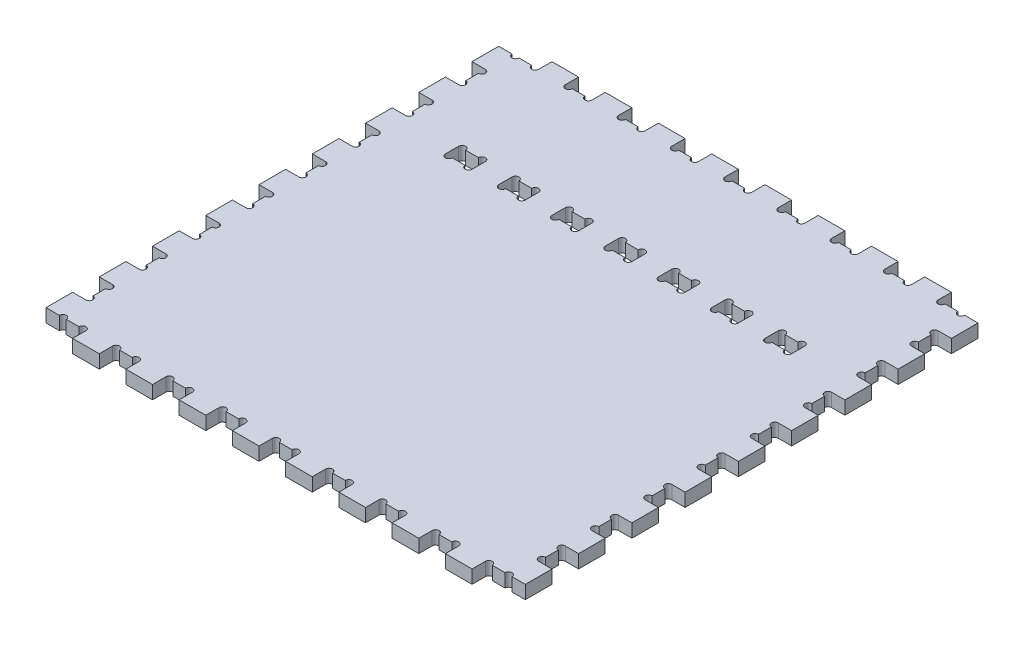
from build123d import *

# Parameters (mm, degrees)
SKETCH1_W               = 457.2
SKETCH1_H               = 457.2
BOSS_EXTRUDE1_DEPTH     = 12.7
CUT_EXTRUDE1_DEPTH      = 12.7
LPATTERN1_COUNT         = 9
LPATTERN1_PITCH         = 50.8
MIRROR1_COPY_1_DEPTH    = 12.7
MIRROR1_COPY_2_DEPTH    = 12.7
MIRROR1_COPY_3_DEPTH    = 12.7
MIRROR1_COPY_4_DEPTH    = 12.7
MIRROR1_COPY_5_DEPTH    = 12.7
MIRROR1_COPY_6_DEPTH    = 12.7
MIRROR1_COPY_7_DEPTH    = 12.7
MIRROR1_COPY_8_DEPTH    = 12.7
SKETCH3_W               = 12.7
SKETCH3_H               = 12.7
CUT_EXTRUDE2_DEPTH      = 324.538575753
MIRROR3_COPY_1_SKETCH_W = 12.7
MIRROR3_COPY_1_SKETCH_H = 12.7
MIRROR3_COPY_1_DEPTH    = 324.538575753
SKETCH4_R               = 3.302
SKETCH4_W               = 12.7
SKETCH4_H               = 25.4
CUT_EXTRUDE3_DEPTH      = 324.538575753
LPATTERN2_COUNT         = 9
LPATTERN2_PITCH         = 50.8
MIRROR4_COPY_1_SKETCH_R = 3.302
MIRROR4_COPY_1_SKETCH_W = 12.7
MIRROR4_COPY_1_SKETCH_H = 25.4
MIRROR4_COPY_1_DEPTH    = 324.538575753
MIRROR4_COPY_2_SKETCH_R = 3.302
MIRROR4_COPY_2_SKETCH_W = 12.7
MIRROR4_COPY_2_SKETCH_H = 25.4
MIRROR4_COPY_2_DEPTH    = 324.538575753
MIRROR4_COPY_3_SKETCH_R = 3.302
MIRROR4_COPY_3_SKETCH_W = 12.7
MIRROR4_COPY_3_SKETCH_H = 25.4
MIRROR4_COPY_3_DEPTH    = 324.538575753
MIRROR4_COPY_4_SKETCH_R = 3.302
MIRROR4_COPY_4_SKETCH_W = 12.7
MIRROR4_COPY_4_SKETCH_H = 25.4
MIRROR4_COPY_4_DEPTH    = 324.538575753
MIRROR4_COPY_5_SKETCH_R = 3.302
MIRROR4_COPY_5_SKETCH_W = 12.7
MIRROR4_COPY_5_SKETCH_H = 25.4
MIRROR4_COPY_5_DEPTH    = 324.538575753
MIRROR4_COPY_6_SKETCH_R = 3.302
MIRROR4_COPY_6_SKETCH_W = 12.7
MIRROR4_COPY_6_SKETCH_H = 25.4
MIRROR4_COPY_6_DEPTH    = 324.538575753
MIRROR4_COPY_7_SKETCH_R = 3.302
MIRROR4_COPY_7_SKETCH_W = 12.7
MIRROR4_COPY_7_SKETCH_H = 25.4
MIRROR4_COPY_7_DEPTH    = 324.538575753
MIRROR4_COPY_8_SKETCH_R = 3.302
MIRROR4_COPY_8_SKETCH_W = 12.7
MIRROR4_COPY_8_SKETCH_H = 25.4
MIRROR4_COPY_8_DEPTH    = 324.538575753
SKETCH5_R               = 3.302
SKETCH5_W               = 25.4
SKETCH5_H               = 12.7
CUT_EXTRUDE4_DEPTH      = 324.538575753
LPATTERN3_COUNT         = 7
LPATTERN3_PITCH         = 50.8


with BuildPart() as part:
    # Sketch1 → Boss-Extrude1 (new body)
    with BuildSketch(Plane(origin=(0, 0, 0), x_dir=(1, 0, 0), z_dir=(0, 1, 0))):
        Rectangle(SKETCH1_W, SKETCH1_H)
    extrude(amount=BOSS_EXTRUDE1_DEPTH)

    # Sketch2 → Cut-Extrude1 (cut)
    with BuildSketch(Plane(origin=(0, 12.7, 0), x_dir=(1, 0, 0), z_dir=(0, 1, 0))):
        with BuildLine():
            Line((-190.5, 228.6), (-215.9, 228.6))
            Line((-215.9, 228.6), (-215.9, 215.9))
            ThreePointArc((-215.9, 215.9), (-212.598, 219.202), (-209.296, 215.9))
            Line((-209.296, 215.9), (-197.104, 215.9))
            ThreePointArc((-197.104, 215.9), (-193.802, 219.202), (-190.5, 215.9))
            Line((-190.5, 215.9), (-190.5, 228.6))
        make_face()
        with BuildLine():
            ThreePointArc((-209.296, 215.9), (-212.598, 219.202), (-215.9, 215.9))
            Line((-215.9, 215.9), (-209.296, 215.9))
        make_face()
        with BuildLine():
            Line((-209.296, 215.9), (-215.9, 215.9))
            ThreePointArc((-215.9, 215.9), (-212.598, 212.598), (-209.296, 215.9))
        make_face()
        with BuildLine():
            ThreePointArc((-197.104, 215.9), (-193.802, 212.598), (-190.5, 215.9))
            Line((-190.5, 215.9), (-197.104, 215.9))
        make_face()
        with BuildLine():
            Line((-197.104, 215.9), (-190.5, 215.9))
            ThreePointArc((-190.5, 215.9), (-193.802, 219.202), (-197.104, 215.9))
        make_face()
    cut_extrude1 = extrude(amount=-CUT_EXTRUDE1_DEPTH, mode=Mode.SUBTRACT)

    # LPattern1: Cut-Extrude1 ×9
    with Locations(*[(i * LPATTERN1_PITCH, 0, 0) for i in range(1, LPATTERN1_COUNT)]):
        add(cut_extrude1, mode=Mode.SUBTRACT)

    # Mirror1: Cut-Extrude1 across plane
    add(cut_extrude1.mirror(Plane(origin=(0, 0, 0), x_dir=(1, 0, 0), z_dir=(0, 0, -1))), mode=Mode.SUBTRACT)

    # Mirror1 copy 1 sketch → Mirror1 copy 1 (cut)
    with BuildSketch(Plane(origin=(50.8, 12.7, 0), x_dir=(1, 0, 0), z_dir=(0, 1, 0))):
        with BuildLine():
            Line((-190.5, -228.6), (-215.9, -228.6))
            Line((-215.9, -228.6), (-215.9, -215.9))
            ThreePointArc((-215.9, -215.9), (-212.598, -219.202), (-209.296, -215.9))
            Line((-209.296, -215.9), (-197.104, -215.9))
            ThreePointArc((-197.104, -215.9), (-193.802, -219.202), (-190.5, -215.9))
            Line((-190.5, -215.9), (-190.5, -228.6))
        make_face()
        with BuildLine():
            ThreePointArc((-209.296, -215.9), (-212.598, -219.202), (-215.9, -215.9))
            Line((-215.9, -215.9), (-209.296, -215.9))
        make_face()
        with BuildLine():
            Line((-209.296, -215.9), (-215.9, -215.9))
            ThreePointArc((-215.9, -215.9), (-212.598, -212.598), (-209.296, -215.9))
        make_face()
        with BuildLine():
            ThreePointArc((-197.104, -215.9), (-193.802, -212.598), (-190.5, -215.9))
            Line((-190.5, -215.9), (-197.104, -215.9))
        make_face()
        with BuildLine():
            Line((-197.104, -215.9), (-190.5, -215.9))
            ThreePointArc((-190.5, -215.9), (-193.802, -219.202), (-197.104, -215.9))
        make_face()
    extrude(amount=-MIRROR1_COPY_1_DEPTH, mode=Mode.SUBTRACT)

    # Mirror1 copy 2 sketch → Mirror1 copy 2 (cut)
    with BuildSketch(Plane(origin=(101.6, 12.7, 0), x_dir=(1, 0, 0), z_dir=(0, 1, 0))):
        with BuildLine():
            Line((-190.5, -228.6), (-215.9, -228.6))
            Line((-215.9, -228.6), (-215.9, -215.9))
            ThreePointArc((-215.9, -215.9), (-212.598, -219.202), (-209.296, -215.9))
            Line((-209.296, -215.9), (-197.104, -215.9))
            ThreePointArc((-197.104, -215.9), (-193.802, -219.202), (-190.5, -215.9))
            Line((-190.5, -215.9), (-190.5, -228.6))
        make_face()
        with BuildLine():
            ThreePointArc((-209.296, -215.9), (-212.598, -219.202), (-215.9, -215.9))
            Line((-215.9, -215.9), (-209.296, -215.9))
        make_face()
        with BuildLine():
            Line((-209.296, -215.9), (-215.9, -215.9))
            ThreePointArc((-215.9, -215.9), (-212.598, -212.598), (-209.296, -215.9))
        make_face()
        with BuildLine():
            ThreePointArc((-197.104, -215.9), (-193.802, -212.598), (-190.5, -215.9))
            Line((-190.5, -215.9), (-197.104, -215.9))
        make_face()
        with BuildLine():
            Line((-197.104, -215.9), (-190.5, -215.9))
            ThreePointArc((-190.5, -215.9), (-193.802, -219.202), (-197.104, -215.9))
        make_face()
    extrude(amount=-MIRROR1_COPY_2_DEPTH, mode=Mode.SUBTRACT)

    # Mirror1 copy 3 sketch → Mirror1 copy 3 (cut)
    with BuildSketch(Plane(origin=(152.4, 12.7, 0), x_dir=(1, 0, 0), z_dir=(0, 1, 0))):
        with BuildLine():
            Line((-190.5, -228.6), (-215.9, -228.6))
            Line((-215.9, -228.6), (-215.9, -215.9))
            ThreePointArc((-215.9, -215.9), (-212.598, -219.202), (-209.296, -215.9))
            Line((-209.296, -215.9), (-197.104, -215.9))
            ThreePointArc((-197.104, -215.9), (-193.802, -219.202), (-190.5, -215.9))
            Line((-190.5, -215.9), (-190.5, -228.6))
        make_face()
        with BuildLine():
            ThreePointArc((-209.296, -215.9), (-212.598, -219.202), (-215.9, -215.9))
            Line((-215.9, -215.9), (-209.296, -215.9))
        make_face()
        with BuildLine():
            Line((-209.296, -215.9), (-215.9, -215.9))
            ThreePointArc((-215.9, -215.9), (-212.598, -212.598), (-209.296, -215.9))
        make_face()
        with BuildLine():
            ThreePointArc((-197.104, -215.9), (-193.802, -212.598), (-190.5, -215.9))
            Line((-190.5, -215.9), (-197.104, -215.9))
        make_face()
        with BuildLine():
            Line((-197.104, -215.9), (-190.5, -215.9))
            ThreePointArc((-190.5, -215.9), (-193.802, -219.202), (-197.104, -215.9))
        make_face()
    extrude(amount=-MIRROR1_COPY_3_DEPTH, mode=Mode.SUBTRACT)

    # Mirror1 copy 4 sketch → Mirror1 copy 4 (cut)
    with BuildSketch(Plane(origin=(203.2, 12.7, 0), x_dir=(1, 0, 0), z_dir=(0, 1, 0))):
        with BuildLine():
            Line((-190.5, -228.6), (-215.9, -228.6))
            Line((-215.9, -228.6), (-215.9, -215.9))
            ThreePointArc((-215.9, -215.9), (-212.598, -219.202), (-209.296, -215.9))
            Line((-209.296, -215.9), (-197.104, -215.9))
            ThreePointArc((-197.104, -215.9), (-193.802, -219.202), (-190.5, -215.9))
            Line((-190.5, -215.9), (-190.5, -228.6))
        make_face()
        with BuildLine():
            ThreePointArc((-209.296, -215.9), (-212.598, -219.202), (-215.9, -215.9))
            Line((-215.9, -215.9), (-209.296, -215.9))
        make_face()
        with BuildLine():
            Line((-209.296, -215.9), (-215.9, -215.9))
            ThreePointArc((-215.9, -215.9), (-212.598, -212.598), (-209.296, -215.9))
        make_face()
        with BuildLine():
            ThreePointArc((-197.104, -215.9), (-193.802, -212.598), (-190.5, -215.9))
            Line((-190.5, -215.9), (-197.104, -215.9))
        make_face()
        with BuildLine():
            Line((-197.104, -215.9), (-190.5, -215.9))
            ThreePointArc((-190.5, -215.9), (-193.802, -219.202), (-197.104, -215.9))
        make_face()
    extrude(amount=-MIRROR1_COPY_4_DEPTH, mode=Mode.SUBTRACT)

    # Mirror1 copy 5 sketch → Mirror1 copy 5 (cut)
    with BuildSketch(Plane(origin=(254, 12.7, 0), x_dir=(1, 0, 0), z_dir=(0, 1, 0))):
        with BuildLine():
            Line((-190.5, -228.6), (-215.9, -228.6))
            Line((-215.9, -228.6), (-215.9, -215.9))
            ThreePointArc((-215.9, -215.9), (-212.598, -219.202), (-209.296, -215.9))
            Line((-209.296, -215.9), (-197.104, -215.9))
            ThreePointArc((-197.104, -215.9), (-193.802, -219.202), (-190.5, -215.9))
            Line((-190.5, -215.9), (-190.5, -228.6))
        make_face()
        with BuildLine():
            ThreePointArc((-209.296, -215.9), (-212.598, -219.202), (-215.9, -215.9))
            Line((-215.9, -215.9), (-209.296, -215.9))
        make_face()
        with BuildLine():
            Line((-209.296, -215.9), (-215.9, -215.9))
            ThreePointArc((-215.9, -215.9), (-212.598, -212.598), (-209.296, -215.9))
        make_face()
        with BuildLine():
            ThreePointArc((-197.104, -215.9), (-193.802, -212.598), (-190.5, -215.9))
            Line((-190.5, -215.9), (-197.104, -215.9))
        make_face()
        with BuildLine():
            Line((-197.104, -215.9), (-190.5, -215.9))
            ThreePointArc((-190.5, -215.9), (-193.802, -219.202), (-197.104, -215.9))
        make_face()
    extrude(amount=-MIRROR1_COPY_5_DEPTH, mode=Mode.SUBTRACT)

    # Mirror1 copy 6 sketch → Mirror1 copy 6 (cut)
    with BuildSketch(Plane(origin=(304.8, 12.7, 0), x_dir=(1, 0, 0), z_dir=(0, 1, 0))):
        with BuildLine():
            Line((-190.5, -228.6), (-215.9, -228.6))
            Line((-215.9, -228.6), (-215.9, -215.9))
            ThreePointArc((-215.9, -215.9), (-212.598, -219.202), (-209.296, -215.9))
            Line((-209.296, -215.9), (-197.104, -215.9))
            ThreePointArc((-197.104, -215.9), (-193.802, -219.202), (-190.5, -215.9))
            Line((-190.5, -215.9), (-190.5, -228.6))
        make_face()
        with BuildLine():
            ThreePointArc((-209.296, -215.9), (-212.598, -219.202), (-215.9, -215.9))
            Line((-215.9, -215.9), (-209.296, -215.9))
        make_face()
        with BuildLine():
            Line((-209.296, -215.9), (-215.9, -215.9))
            ThreePointArc((-215.9, -215.9), (-212.598, -212.598), (-209.296, -215.9))
        make_face()
        with BuildLine():
            ThreePointArc((-197.104, -215.9), (-193.802, -212.598), (-190.5, -215.9))
            Line((-190.5, -215.9), (-197.104, -215.9))
        make_face()
        with BuildLine():
            Line((-197.104, -215.9), (-190.5, -215.9))
            ThreePointArc((-190.5, -215.9), (-193.802, -219.202), (-197.104, -215.9))
        make_face()
    extrude(amount=-MIRROR1_COPY_6_DEPTH, mode=Mode.SUBTRACT)

    # Mirror1 copy 7 sketch → Mirror1 copy 7 (cut)
    with BuildSketch(Plane(origin=(355.6, 12.7, 0), x_dir=(1, 0, 0), z_dir=(0, 1, 0))):
        with BuildLine():
            Line((-190.5, -228.6), (-215.9, -228.6))
            Line((-215.9, -228.6), (-215.9, -215.9))
            ThreePointArc((-215.9, -215.9), (-212.598, -219.202), (-209.296, -215.9))
            Line((-209.296, -215.9), (-197.104, -215.9))
            ThreePointArc((-197.104, -215.9), (-193.802, -219.202), (-190.5, -215.9))
            Line((-190.5, -215.9), (-190.5, -228.6))
        make_face()
        with BuildLine():
            ThreePointArc((-209.296, -215.9), (-212.598, -219.202), (-215.9, -215.9))
            Line((-215.9, -215.9), (-209.296, -215.9))
        make_face()
        with BuildLine():
            Line((-209.296, -215.9), (-215.9, -215.9))
            ThreePointArc((-215.9, -215.9), (-212.598, -212.598), (-209.296, -215.9))
        make_face()
        with BuildLine():
            ThreePointArc((-197.104, -215.9), (-193.802, -212.598), (-190.5, -215.9))
            Line((-190.5, -215.9), (-197.104, -215.9))
        make_face()
        with BuildLine():
            Line((-197.104, -215.9), (-190.5, -215.9))
            ThreePointArc((-190.5, -215.9), (-193.802, -219.202), (-197.104, -215.9))
        make_face()
    extrude(amount=-MIRROR1_COPY_7_DEPTH, mode=Mode.SUBTRACT)

    # Mirror1 copy 8 sketch → Mirror1 copy 8 (cut)
    with BuildSketch(Plane(origin=(406.4, 12.7, 0), x_dir=(1, 0, 0), z_dir=(0, 1, 0))):
        with BuildLine():
            Line((-190.5, -228.6), (-215.9, -228.6))
            Line((-215.9, -228.6), (-215.9, -215.9))
            ThreePointArc((-215.9, -215.9), (-212.598, -219.202), (-209.296, -215.9))
            Line((-209.296, -215.9), (-197.104, -215.9))
            ThreePointArc((-197.104, -215.9), (-193.802, -219.202), (-190.5, -215.9))
            Line((-190.5, -215.9), (-190.5, -228.6))
        make_face()
        with BuildLine():
            ThreePointArc((-209.296, -215.9), (-212.598, -219.202), (-215.9, -215.9))
            Line((-215.9, -215.9), (-209.296, -215.9))
        make_face()
        with BuildLine():
            Line((-209.296, -215.9), (-215.9, -215.9))
            ThreePointArc((-215.9, -215.9), (-212.598, -212.598), (-209.296, -215.9))
        make_face()
        with BuildLine():
            ThreePointArc((-197.104, -215.9), (-193.802, -212.598), (-190.5, -215.9))
            Line((-190.5, -215.9), (-197.104, -215.9))
        make_face()
        with BuildLine():
            Line((-197.104, -215.9), (-190.5, -215.9))
            ThreePointArc((-190.5, -215.9), (-193.802, -219.202), (-197.104, -215.9))
        make_face()
    extrude(amount=-MIRROR1_COPY_8_DEPTH, mode=Mode.SUBTRACT)

    # Sketch3 → Cut-Extrude2 (cut, through all)
    with BuildSketch(Plane(origin=(0, 12.7, 0), x_dir=(1, 0, 0), z_dir=(0, 1, 0))):
        with Locations((-222.25, 222.25)):
            Rectangle(SKETCH3_W, SKETCH3_H)
    cut_extrude2 = extrude(amount=-CUT_EXTRUDE2_DEPTH, mode=Mode.SUBTRACT)

    # Mirror2: Cut-Extrude2 across plane
    add(cut_extrude2.mirror(Plane.ZY), mode=Mode.SUBTRACT)

    # Mirror3: Cut-Extrude2 across plane
    add(cut_extrude2.mirror(Plane(origin=(0, 0, 0), x_dir=(1, 0, 0), z_dir=(0, 0, -1))), mode=Mode.SUBTRACT)

    # Mirror3 copy 1 sketch → Mirror3 copy 1 (cut, through all)
    with BuildSketch(Plane(origin=(0, 12.7, 0), x_dir=(-1, 0, 0), z_dir=(0, 1, 0))):
        with Locations((-222.25, 222.25)):
            Rectangle(MIRROR3_COPY_1_SKETCH_W, MIRROR3_COPY_1_SKETCH_H)
    extrude(amount=-MIRROR3_COPY_1_DEPTH, mode=Mode.SUBTRACT)

    # Sketch4 → Cut-Extrude3 (cut, through all)
    with BuildSketch(Plane(origin=(0, 12.7, 0), x_dir=(1, 0, 0), z_dir=(0, 1, 0))):
        with Locations((-215.9, 168.402)):
            Circle(SKETCH4_R)
        with Locations((-215.9, 187.198)):
            Circle(SKETCH4_R)
        with Locations((-222.25, 177.8)):
            Rectangle(SKETCH4_W, SKETCH4_H)
        with BuildLine():
            ThreePointArc((-212.598, 187.198), (-213.565133409, 189.532866591), (-215.9, 190.5))
            Line((-215.9, 190.5), (-215.9, 183.896))
            ThreePointArc((-215.9, 183.896), (-213.565133409, 184.863133409), (-212.598, 187.198))
        make_face()
        with BuildLine():
            Line((-215.9, 183.896), (-215.9, 190.5))
            ThreePointArc((-215.9, 190.5), (-219.202, 187.198), (-215.9, 183.896))
        make_face()
        with BuildLine():
            ThreePointArc((-215.9, 171.704), (-219.202, 168.402), (-215.9, 165.1))
            Line((-215.9, 165.1), (-215.9, 171.704))
        make_face()
        with BuildLine():
            Line((-215.9, 171.704), (-215.9, 165.1))
            ThreePointArc((-215.9, 165.1), (-213.565133409, 166.067133409), (-212.598, 168.402))
            ThreePointArc((-212.598, 168.402), (-213.565133409, 170.736866591), (-215.9, 171.704))
        make_face()
    cut_extrude3 = extrude(amount=-CUT_EXTRUDE3_DEPTH, mode=Mode.SUBTRACT)

    # LPattern2: Cut-Extrude3 ×9
    with Locations(*[(0, 0, i * LPATTERN2_PITCH) for i in range(1, LPATTERN2_COUNT)]):
        add(cut_extrude3, mode=Mode.SUBTRACT)

    # Mirror4: Cut-Extrude3 across plane
    add(cut_extrude3.mirror(Plane.ZY), mode=Mode.SUBTRACT)

    # Mirror4 copy 1 sketch → Mirror4 copy 1 (cut, through all)
    with BuildSketch(Plane(origin=(0, 12.7, 50.8), x_dir=(-1, 0, 0), z_dir=(0, 1, 0))):
        with Locations((-215.9, -168.402)):
            Circle(MIRROR4_COPY_1_SKETCH_R)
        with Locations((-215.9, -187.198)):
            Circle(MIRROR4_COPY_1_SKETCH_R)
        with Locations((-222.25, -177.8)):
            Rectangle(MIRROR4_COPY_1_SKETCH_W, MIRROR4_COPY_1_SKETCH_H)
        with BuildLine():
            ThreePointArc((-212.598, -187.198), (-213.565133409, -189.532866591), (-215.9, -190.5))
            Line((-215.9, -190.5), (-215.9, -183.896))
            ThreePointArc((-215.9, -183.896), (-213.565133409, -184.863133409), (-212.598, -187.198))
        make_face()
        with BuildLine():
            Line((-215.9, -183.896), (-215.9, -190.5))
            ThreePointArc((-215.9, -190.5), (-219.202, -187.198), (-215.9, -183.896))
        make_face()
        with BuildLine():
            ThreePointArc((-215.9, -171.704), (-219.202, -168.402), (-215.9, -165.1))
            Line((-215.9, -165.1), (-215.9, -171.704))
        make_face()
        with BuildLine():
            Line((-215.9, -171.704), (-215.9, -165.1))
            ThreePointArc((-215.9, -165.1), (-213.565133409, -166.067133409), (-212.598, -168.402))
            ThreePointArc((-212.598, -168.402), (-213.565133409, -170.736866591), (-215.9, -171.704))
        make_face()
    extrude(amount=-MIRROR4_COPY_1_DEPTH, mode=Mode.SUBTRACT)

    # Mirror4 copy 2 sketch → Mirror4 copy 2 (cut, through all)
    with BuildSketch(Plane(origin=(0, 12.7, 101.6), x_dir=(-1, 0, 0), z_dir=(0, 1, 0))):
        with Locations((-215.9, -168.402)):
            Circle(MIRROR4_COPY_2_SKETCH_R)
        with Locations((-215.9, -187.198)):
            Circle(MIRROR4_COPY_2_SKETCH_R)
        with Locations((-222.25, -177.8)):
            Rectangle(MIRROR4_COPY_2_SKETCH_W, MIRROR4_COPY_2_SKETCH_H)
        with BuildLine():
            ThreePointArc((-212.598, -187.198), (-213.565133409, -189.532866591), (-215.9, -190.5))
            Line((-215.9, -190.5), (-215.9, -183.896))
            ThreePointArc((-215.9, -183.896), (-213.565133409, -184.863133409), (-212.598, -187.198))
        make_face()
        with BuildLine():
            Line((-215.9, -183.896), (-215.9, -190.5))
            ThreePointArc((-215.9, -190.5), (-219.202, -187.198), (-215.9, -183.896))
        make_face()
        with BuildLine():
            ThreePointArc((-215.9, -171.704), (-219.202, -168.402), (-215.9, -165.1))
            Line((-215.9, -165.1), (-215.9, -171.704))
        make_face()
        with BuildLine():
            Line((-215.9, -171.704), (-215.9, -165.1))
            ThreePointArc((-215.9, -165.1), (-213.565133409, -166.067133409), (-212.598, -168.402))
            ThreePointArc((-212.598, -168.402), (-213.565133409, -170.736866591), (-215.9, -171.704))
        make_face()
    extrude(amount=-MIRROR4_COPY_2_DEPTH, mode=Mode.SUBTRACT)

    # Mirror4 copy 3 sketch → Mirror4 copy 3 (cut, through all)
    with BuildSketch(Plane(origin=(0, 12.7, 152.4), x_dir=(-1, 0, 0), z_dir=(0, 1, 0))):
        with Locations((-215.9, -168.402)):
            Circle(MIRROR4_COPY_3_SKETCH_R)
        with Locations((-215.9, -187.198)):
            Circle(MIRROR4_COPY_3_SKETCH_R)
        with Locations((-222.25, -177.8)):
            Rectangle(MIRROR4_COPY_3_SKETCH_W, MIRROR4_COPY_3_SKETCH_H)
        with BuildLine():
            ThreePointArc((-212.598, -187.198), (-213.565133409, -189.532866591), (-215.9, -190.5))
            Line((-215.9, -190.5), (-215.9, -183.896))
            ThreePointArc((-215.9, -183.896), (-213.565133409, -184.863133409), (-212.598, -187.198))
        make_face()
        with BuildLine():
            Line((-215.9, -183.896), (-215.9, -190.5))
            ThreePointArc((-215.9, -190.5), (-219.202, -187.198), (-215.9, -183.896))
        make_face()
        with BuildLine():
            ThreePointArc((-215.9, -171.704), (-219.202, -168.402), (-215.9, -165.1))
            Line((-215.9, -165.1), (-215.9, -171.704))
        make_face()
        with BuildLine():
            Line((-215.9, -171.704), (-215.9, -165.1))
            ThreePointArc((-215.9, -165.1), (-213.565133409, -166.067133409), (-212.598, -168.402))
            ThreePointArc((-212.598, -168.402), (-213.565133409, -170.736866591), (-215.9, -171.704))
        make_face()
    extrude(amount=-MIRROR4_COPY_3_DEPTH, mode=Mode.SUBTRACT)

    # Mirror4 copy 4 sketch → Mirror4 copy 4 (cut, through all)
    with BuildSketch(Plane(origin=(0, 12.7, 203.2), x_dir=(-1, 0, 0), z_dir=(0, 1, 0))):
        with Locations((-215.9, -168.402)):
            Circle(MIRROR4_COPY_4_SKETCH_R)
        with Locations((-215.9, -187.198)):
            Circle(MIRROR4_COPY_4_SKETCH_R)
        with Locations((-222.25, -177.8)):
            Rectangle(MIRROR4_COPY_4_SKETCH_W, MIRROR4_COPY_4_SKETCH_H)
        with BuildLine():
            ThreePointArc((-212.598, -187.198), (-213.565133409, -189.532866591), (-215.9, -190.5))
            Line((-215.9, -190.5), (-215.9, -183.896))
            ThreePointArc((-215.9, -183.896), (-213.565133409, -184.863133409), (-212.598, -187.198))
        make_face()
        with BuildLine():
            Line((-215.9, -183.896), (-215.9, -190.5))
            ThreePointArc((-215.9, -190.5), (-219.202, -187.198), (-215.9, -183.896))
        make_face()
        with BuildLine():
            ThreePointArc((-215.9, -171.704), (-219.202, -168.402), (-215.9, -165.1))
            Line((-215.9, -165.1), (-215.9, -171.704))
        make_face()
        with BuildLine():
            Line((-215.9, -171.704), (-215.9, -165.1))
            ThreePointArc((-215.9, -165.1), (-213.565133409, -166.067133409), (-212.598, -168.402))
            ThreePointArc((-212.598, -168.402), (-213.565133409, -170.736866591), (-215.9, -171.704))
        make_face()
    extrude(amount=-MIRROR4_COPY_4_DEPTH, mode=Mode.SUBTRACT)

    # Mirror4 copy 5 sketch → Mirror4 copy 5 (cut, through all)
    with BuildSketch(Plane(origin=(0, 12.7, 254), x_dir=(-1, 0, 0), z_dir=(0, 1, 0))):
        with Locations((-215.9, -168.402)):
            Circle(MIRROR4_COPY_5_SKETCH_R)
        with Locations((-215.9, -187.198)):
            Circle(MIRROR4_COPY_5_SKETCH_R)
        with Locations((-222.25, -177.8)):
            Rectangle(MIRROR4_COPY_5_SKETCH_W, MIRROR4_COPY_5_SKETCH_H)
        with BuildLine():
            ThreePointArc((-212.598, -187.198), (-213.565133409, -189.532866591), (-215.9, -190.5))
            Line((-215.9, -190.5), (-215.9, -183.896))
            ThreePointArc((-215.9, -183.896), (-213.565133409, -184.863133409), (-212.598, -187.198))
        make_face()
        with BuildLine():
            Line((-215.9, -183.896), (-215.9, -190.5))
            ThreePointArc((-215.9, -190.5), (-219.202, -187.198), (-215.9, -183.896))
        make_face()
        with BuildLine():
            ThreePointArc((-215.9, -171.704), (-219.202, -168.402), (-215.9, -165.1))
            Line((-215.9, -165.1), (-215.9, -171.704))
        make_face()
        with BuildLine():
            Line((-215.9, -171.704), (-215.9, -165.1))
            ThreePointArc((-215.9, -165.1), (-213.565133409, -166.067133409), (-212.598, -168.402))
            ThreePointArc((-212.598, -168.402), (-213.565133409, -170.736866591), (-215.9, -171.704))
        make_face()
    extrude(amount=-MIRROR4_COPY_5_DEPTH, mode=Mode.SUBTRACT)

    # Mirror4 copy 6 sketch → Mirror4 copy 6 (cut, through all)
    with BuildSketch(Plane(origin=(0, 12.7, 304.8), x_dir=(-1, 0, 0), z_dir=(0, 1, 0))):
        with Locations((-215.9, -168.402)):
            Circle(MIRROR4_COPY_6_SKETCH_R)
        with Locations((-215.9, -187.198)):
            Circle(MIRROR4_COPY_6_SKETCH_R)
        with Locations((-222.25, -177.8)):
            Rectangle(MIRROR4_COPY_6_SKETCH_W, MIRROR4_COPY_6_SKETCH_H)
        with BuildLine():
            ThreePointArc((-212.598, -187.198), (-213.565133409, -189.532866591), (-215.9, -190.5))
            Line((-215.9, -190.5), (-215.9, -183.896))
            ThreePointArc((-215.9, -183.896), (-213.565133409, -184.863133409), (-212.598, -187.198))
        make_face()
        with BuildLine():
            Line((-215.9, -183.896), (-215.9, -190.5))
            ThreePointArc((-215.9, -190.5), (-219.202, -187.198), (-215.9, -183.896))
        make_face()
        with BuildLine():
            ThreePointArc((-215.9, -171.704), (-219.202, -168.402), (-215.9, -165.1))
            Line((-215.9, -165.1), (-215.9, -171.704))
        make_face()
        with BuildLine():
            Line((-215.9, -171.704), (-215.9, -165.1))
            ThreePointArc((-215.9, -165.1), (-213.565133409, -166.067133409), (-212.598, -168.402))
            ThreePointArc((-212.598, -168.402), (-213.565133409, -170.736866591), (-215.9, -171.704))
        make_face()
    extrude(amount=-MIRROR4_COPY_6_DEPTH, mode=Mode.SUBTRACT)

    # Mirror4 copy 7 sketch → Mirror4 copy 7 (cut, through all)
    with BuildSketch(Plane(origin=(0, 12.7, 355.6), x_dir=(-1, 0, 0), z_dir=(0, 1, 0))):
        with Locations((-215.9, -168.402)):
            Circle(MIRROR4_COPY_7_SKETCH_R)
        with Locations((-215.9, -187.198)):
            Circle(MIRROR4_COPY_7_SKETCH_R)
        with Locations((-222.25, -177.8)):
            Rectangle(MIRROR4_COPY_7_SKETCH_W, MIRROR4_COPY_7_SKETCH_H)
        with BuildLine():
            ThreePointArc((-212.598, -187.198), (-213.565133409, -189.532866591), (-215.9, -190.5))
            Line((-215.9, -190.5), (-215.9, -183.896))
            ThreePointArc((-215.9, -183.896), (-213.565133409, -184.863133409), (-212.598, -187.198))
        make_face()
        with BuildLine():
            Line((-215.9, -183.896), (-215.9, -190.5))
            ThreePointArc((-215.9, -190.5), (-219.202, -187.198), (-215.9, -183.896))
        make_face()
        with BuildLine():
            ThreePointArc((-215.9, -171.704), (-219.202, -168.402), (-215.9, -165.1))
            Line((-215.9, -165.1), (-215.9, -171.704))
        make_face()
        with BuildLine():
            Line((-215.9, -171.704), (-215.9, -165.1))
            ThreePointArc((-215.9, -165.1), (-213.565133409, -166.067133409), (-212.598, -168.402))
            ThreePointArc((-212.598, -168.402), (-213.565133409, -170.736866591), (-215.9, -171.704))
        make_face()
    extrude(amount=-MIRROR4_COPY_7_DEPTH, mode=Mode.SUBTRACT)

    # Mirror4 copy 8 sketch → Mirror4 copy 8 (cut, through all)
    with BuildSketch(Plane(origin=(0, 12.7, 406.4), x_dir=(-1, 0, 0), z_dir=(0, 1, 0))):
        with Locations((-215.9, -168.402)):
            Circle(MIRROR4_COPY_8_SKETCH_R)
        with Locations((-215.9, -187.198)):
            Circle(MIRROR4_COPY_8_SKETCH_R)
        with Locations((-222.25, -177.8)):
            Rectangle(MIRROR4_COPY_8_SKETCH_W, MIRROR4_COPY_8_SKETCH_H)
        with BuildLine():
            ThreePointArc((-212.598, -187.198), (-213.565133409, -189.532866591), (-215.9, -190.5))
            Line((-215.9, -190.5), (-215.9, -183.896))
            ThreePointArc((-215.9, -183.896), (-213.565133409, -184.863133409), (-212.598, -187.198))
        make_face()
        with BuildLine():
            Line((-215.9, -183.896), (-215.9, -190.5))
            ThreePointArc((-215.9, -190.5), (-219.202, -187.198), (-215.9, -183.896))
        make_face()
        with BuildLine():
            ThreePointArc((-215.9, -171.704), (-219.202, -168.402), (-215.9, -165.1))
            Line((-215.9, -165.1), (-215.9, -171.704))
        make_face()
        with BuildLine():
            Line((-215.9, -171.704), (-215.9, -165.1))
            ThreePointArc((-215.9, -165.1), (-213.565133409, -166.067133409), (-212.598, -168.402))
            ThreePointArc((-212.598, -168.402), (-213.565133409, -170.736866591), (-215.9, -171.704))
        make_face()
    extrude(amount=-MIRROR4_COPY_8_DEPTH, mode=Mode.SUBTRACT)

    # Sketch5 → Cut-Extrude4 (cut, through all)
    with BuildSketch(Plane(origin=(0, 12.7, 0), x_dir=(1, 0, 0), z_dir=(0, 1, 0))):
        with Locations((-143.002, 101.6)):
            Circle(SKETCH5_R)
        with Locations((-143.002, 114.3)):
            Circle(SKETCH5_R)
        with Locations((-161.798, 114.3)):
            Circle(SKETCH5_R)
        with Locations((-161.798, 101.6)):
            Circle(SKETCH5_R)
        with Locations((-152.4, 107.95)):
            Rectangle(SKETCH5_W, SKETCH5_H)
        with BuildLine():
            ThreePointArc((-158.496, 114.3), (-161.798, 117.602), (-165.1, 114.3))
            Line((-165.1, 114.3), (-158.496, 114.3))
        make_face()
        with BuildLine():
            Line((-158.496, 114.3), (-165.1, 114.3))
            ThreePointArc((-165.1, 114.3), (-161.798, 110.998), (-158.496, 114.3))
        make_face()
        with BuildLine():
            ThreePointArc((-158.496, 101.6), (-161.798, 104.902), (-165.1, 101.6))
            Line((-165.1, 101.6), (-158.496, 101.6))
        make_face()
        with BuildLine():
            Line((-158.496, 101.6), (-165.1, 101.6))
            ThreePointArc((-165.1, 101.6), (-161.798, 98.298), (-158.496, 101.6))
        make_face()
        with BuildLine():
            ThreePointArc((-139.7, 101.6), (-143.002, 104.902), (-146.304, 101.6))
            Line((-146.304, 101.6), (-139.7, 101.6))
        make_face()
        with BuildLine():
            Line((-139.7, 101.6), (-146.304, 101.6))
            ThreePointArc((-146.304, 101.6), (-143.002, 98.298), (-139.7, 101.6))
        make_face()
    cut_extrude4 = extrude(amount=-CUT_EXTRUDE4_DEPTH, mode=Mode.SUBTRACT)

    # LPattern3: Cut-Extrude4 ×7
    with Locations(*[(i * LPATTERN3_PITCH, 0, 0) for i in range(1, LPATTERN3_COUNT)]):
        add(cut_extrude4, mode=Mode.SUBTRACT)


solid = part.part
